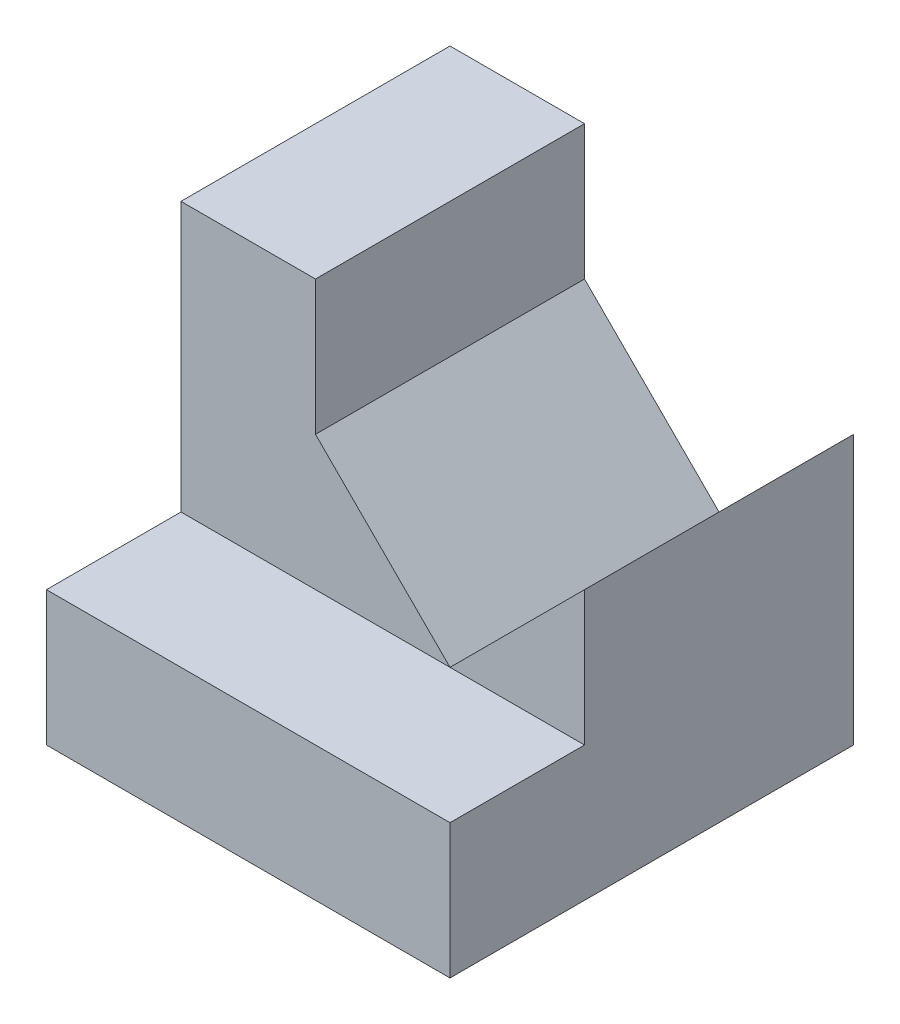
from build123d import *

# Parameters (mm, degrees)
SKETCH_1_W           = 30
SKETCH_1_H           = 30
EXTRUDE_1_DEPTH      = 30
SKETCH_28_W          = 20
SKETCH_28_H          = 10
CUT_EXTRUDE_18_DEPTH = 52.961524227
SKETCH_29_W          = 10
SKETCH_29_H          = 10
CUT_EXTRUDE_19_DEPTH = 52.961524227


with BuildPart() as part:
    # 草圖1 → 填料-伸1 (new body)
    with BuildSketch(Plane.XY):
        with Locations((15, 15)):
            Rectangle(SKETCH_1_W, SKETCH_1_H)
    extrude(amount=-EXTRUDE_1_DEPTH)

    # 草圖28 → 除料-伸長18 (cut, through all)
    with BuildSketch(Plane.XY):
        with Locations((20, 25)):
            Rectangle(SKETCH_28_W, SKETCH_28_H)
        Polygon((10, 20), (30, 20), (20, 10), align=None)
    extrude(amount=-CUT_EXTRUDE_18_DEPTH, mode=Mode.SUBTRACT)

    # 草圖29 → 除料-伸長19 (cut, through all)
    with BuildSketch(Plane(origin=(30, 0, 0), x_dir=(0, 0, -1), z_dir=(1, 0, 0))):
        with Locations((5, 25)):
            Rectangle(SKETCH_29_W, SKETCH_29_H)
        with Locations((5, 15)):
            Rectangle(SKETCH_29_W, SKETCH_29_H)
    extrude(amount=-CUT_EXTRUDE_19_DEPTH, mode=Mode.SUBTRACT)


solid = part.part
